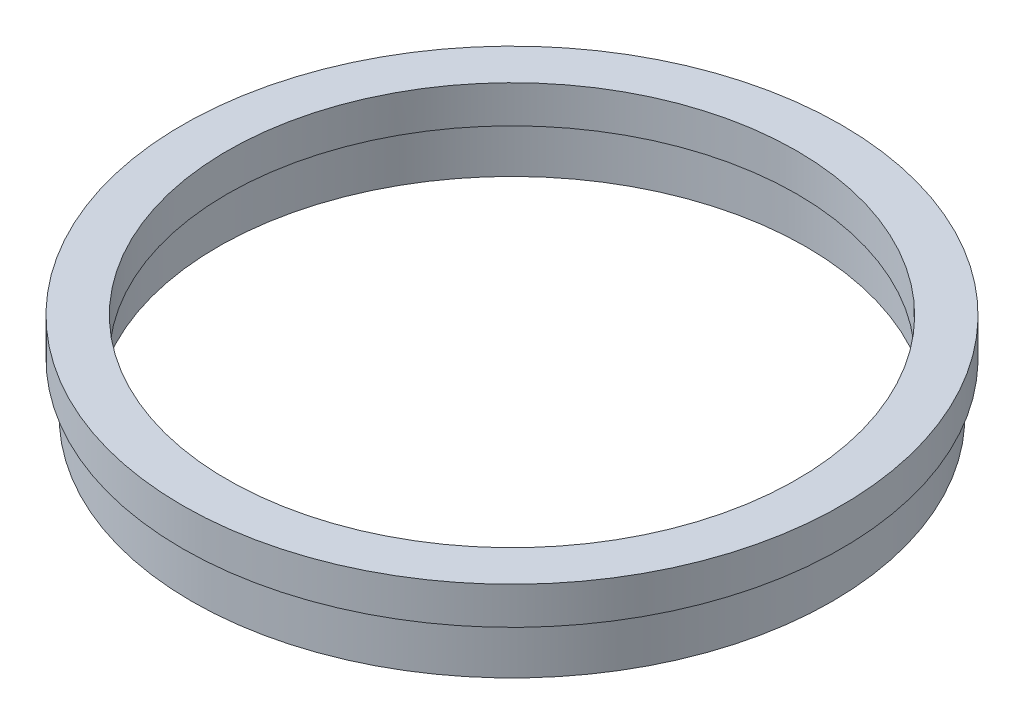
from build123d import *

# Parameters (mm, degrees)
SKETCH_1_R               = 34.4
SKETCH_1_R_2             = 31.4
EXTRUDE_1_DEPTH          = 5.4
SKETCH_2_R               = 35.4
SKETCH_2_R_2             = 30.4
EXTRUDE_1_2_DEPTH        = 4
SKETCH_3_R               = 0.5
CUT_EXTRUDE_1_DEPTH      = 3
PATTERN_CIRCULAR_1_COUNT = 6
SKETCH_4_OUTSIDE_W       = 92.914
SKETCH_4_OUTSIDE_H       = 92.914
SKETCH_4_OUTSIDE_R       = 34.3
SKETCH_4_OUTSIDE_R_2     = 31.5
CUT_EXTRUDE_2_DEPTH      = 5.4
SKETCH_5_OUTSIDE_W       = 92.914
SKETCH_5_OUTSIDE_H       = 92.914
SKETCH_5_OUTSIDE_R       = 35.3
SKETCH_5_OUTSIDE_R_2     = 30.5
CUT_EXTRUDE_3_DEPTH      = 51.938001531


with BuildPart() as part:
    # 草图1 → Extrude 1 (new body)
    with BuildSketch(Plane(origin=(0, 0, 0), x_dir=(1, 0, 0), z_dir=(0, 1, 0))):
        Circle(SKETCH_1_R)
        Circle(SKETCH_1_R_2, mode=Mode.SUBTRACT)
    extrude(amount=EXTRUDE_1_DEPTH)

    # 草图2 → Extrude 1 2 (add)
    with BuildSketch(Plane(origin=(0, 5.4, 0), x_dir=(1, 0, 0), z_dir=(0, 1, 0))):
        with Locations(Location((0, 0, 0), (0, 0, 270))):
            Circle(SKETCH_2_R)
        with Locations(Location((0, 0, 0), (0, 0, 270))):
            Circle(SKETCH_2_R_2, mode=Mode.SUBTRACT)
    extrude(amount=EXTRUDE_1_2_DEPTH)

    # 草图3 → 切除-拉伸1 (cut)
    with BuildSketch(Plane.XZ):
        with Locations(Location((0, 32.9, 0), (0, 0, 270))):
            Circle(SKETCH_3_R)
    cut_extrude_1 = extrude(amount=-CUT_EXTRUDE_1_DEPTH, mode=Mode.SUBTRACT)

    # 阵列(圆周)1: 切除-拉伸1 ×6 about axis
    pattern_circular_1_axis = Axis((0, 0, 0), (0, 1, 0))
    for i in range(1, PATTERN_CIRCULAR_1_COUNT):
        add(cut_extrude_1.rotate(pattern_circular_1_axis, i * 360 / PATTERN_CIRCULAR_1_COUNT), mode=Mode.SUBTRACT)

    # 草图4 outside → 切除-拉伸2 (cut)
    # profile 1 of 2: a face of its own
    with BuildSketch(Plane.XZ):
        Rectangle(SKETCH_4_OUTSIDE_W, SKETCH_4_OUTSIDE_H)
        with Locations(Location((0, 0, 0), (0, 0, 270))):
            Circle(SKETCH_4_OUTSIDE_R, mode=Mode.SUBTRACT)
    # profile 2 of 2: a face of its own
    with BuildSketch(Plane.XZ):
        with Locations(Location((0, 0, 0), (0, 0, 270))):
            Circle(SKETCH_4_OUTSIDE_R_2)
    extrude(amount=-CUT_EXTRUDE_2_DEPTH, mode=Mode.SUBTRACT)

    # 草图5 outside → 切除-拉伸3 (cut, through all)
    # profile 1 of 2: a face of its own
    with BuildSketch(Plane.XZ):
        Rectangle(SKETCH_5_OUTSIDE_W, SKETCH_5_OUTSIDE_H)
        with Locations(Location((0, 0, 0), (0, 0, 270))):
            Circle(SKETCH_5_OUTSIDE_R, mode=Mode.SUBTRACT)
    # profile 2 of 2: a face of its own
    with BuildSketch(Plane.XZ):
        with Locations(Location((0, 0, 0), (0, 0, 270))):
            Circle(SKETCH_5_OUTSIDE_R_2)
    extrude(amount=-CUT_EXTRUDE_3_DEPTH, mode=Mode.SUBTRACT)


solid = part.part
